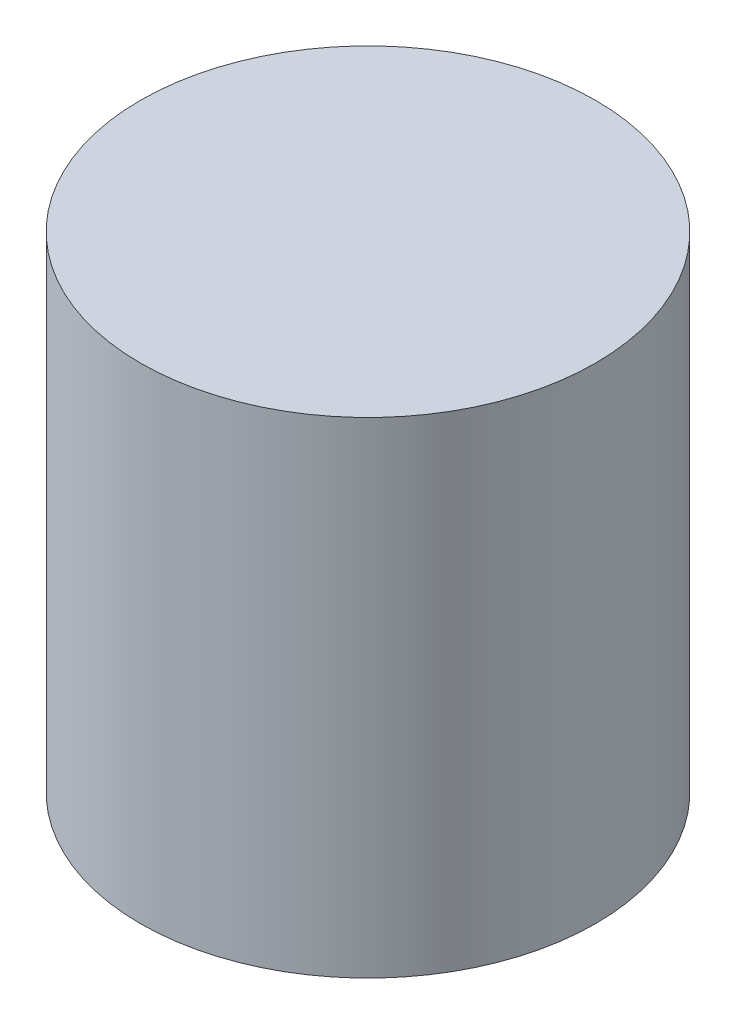
from build123d import *

# Parameters (mm, degrees)
ESQUISSE1_R             = 37.5
BOSS_EXTRU_1_DEPTH      = 80
ESQUISSE2_R             = 4
ENL_V_MAT_EXTRU_1_DEPTH = 13.7


with BuildPart() as part:
    # Esquisse1 → Boss.-Extru.1 (new body)
    with BuildSketch(Plane(origin=(0, 0, 0), x_dir=(1, 0, 0), z_dir=(0, 1, 0))):
        with Locations(Location((0, 0, 0), (0, 0, 270))):
            Circle(ESQUISSE1_R)
    extrude(amount=BOSS_EXTRU_1_DEPTH)

    # Esquisse2 → Enlèv. mat.-Extru.1 (cut)
    with BuildSketch(Plane.XZ):
        with Locations(Location((0, 0, 0), (0, 0, 270))):
            Circle(ESQUISSE2_R)
    extrude(amount=-ENL_V_MAT_EXTRU_1_DEPTH, mode=Mode.SUBTRACT)


solid = part.part
